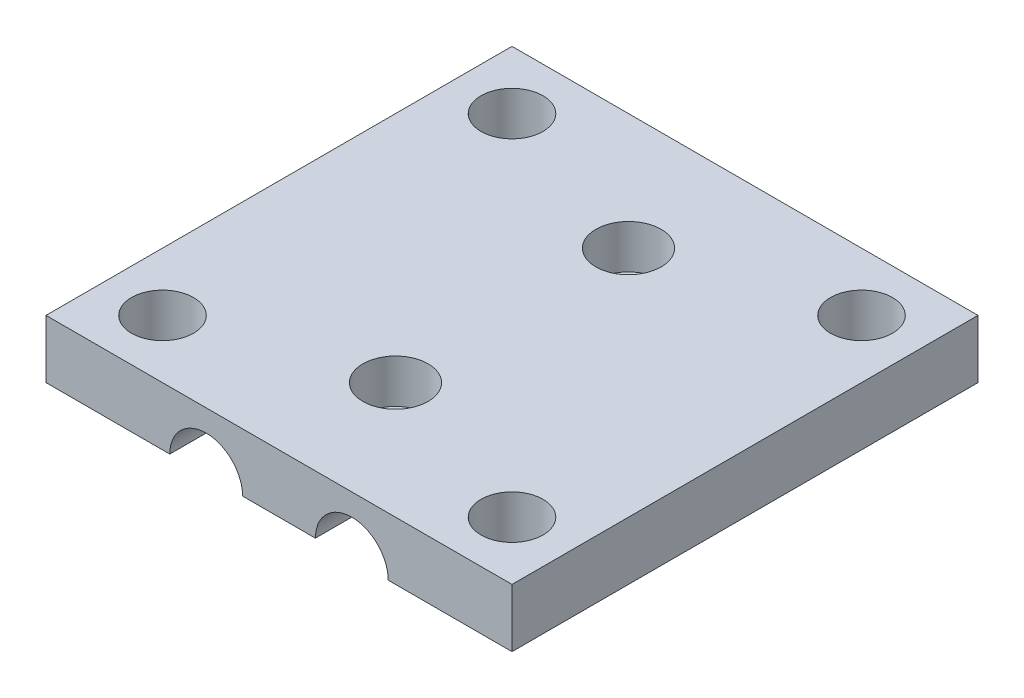
from build123d import *

# Parameters (mm, degrees)
SKETCH1_W               = 50.8
SKETCH1_H               = 50.8
BOSS_EXTRUDE1_DEPTH     = 6.35
SKETCH2_R               = 3.96875
CUT_EXTRUDE1_DEPTH      = 58.15
F_1_4_CLEARANCE_HOLE1_D = 6.7564
F_8_CLEARANCE_HOLE1_D   = 4.4958
SKETCH10_R              = 3.556
CUT_EXTRUDE2_DEPTH      = 4.7625


with BuildPart() as part:
    # Sketch1 → Boss-Extrude1 (new body)
    with BuildSketch(Plane(origin=(0, 0, 0), x_dir=(1, 0, 0), z_dir=(0, 1, 0))):
        Rectangle(SKETCH1_W, SKETCH1_H)
    extrude(amount=BOSS_EXTRUDE1_DEPTH)

    # Sketch2 → Cut-Extrude1 (cut, through all)
    with BuildSketch(Plane.XY.offset(25.4)):
        with Locations((-7.9375, 0)):
            Circle(SKETCH2_R)
        with Locations((7.9375, 0)):
            Circle(SKETCH2_R)
    extrude(amount=-CUT_EXTRUDE1_DEPTH, mode=Mode.SUBTRACT)

    # 1/4 Clearance Hole1 (through all)
    with Locations(Plane(origin=(0, 6.35, 0), x_dir=(1, 0, 0), z_dir=(0, 1, 0))):
        with Locations((-19.05, -19.05), (-19.05, 19.05), (19.05, 19.05), (19.05, -19.05)):
            Hole(F_1_4_CLEARANCE_HOLE1_D / 2)

    # #8 Clearance Hole1 (through all)
    with Locations(Plane(origin=(0, 6.35, 0), x_dir=(1, 0, 0), z_dir=(0, 1, 0))):
        with Locations((0, 12.7), (0, -12.7)):
            Hole(F_8_CLEARANCE_HOLE1_D / 2)

    # Sketch10 → Cut-Extrude2 (cut)
    with BuildSketch(Plane(origin=(0, 6.35, 0), x_dir=(1, 0, 0), z_dir=(0, 1, 0))):
        with Locations(Location((0, 12.7, 0), (0, 0, 270))):
            Circle(SKETCH10_R)
        with Locations(Location((0, -12.7, 0), (0, 0, 270))):
            Circle(SKETCH10_R)
    extrude(amount=-CUT_EXTRUDE2_DEPTH, mode=Mode.SUBTRACT)


solid = part.part
